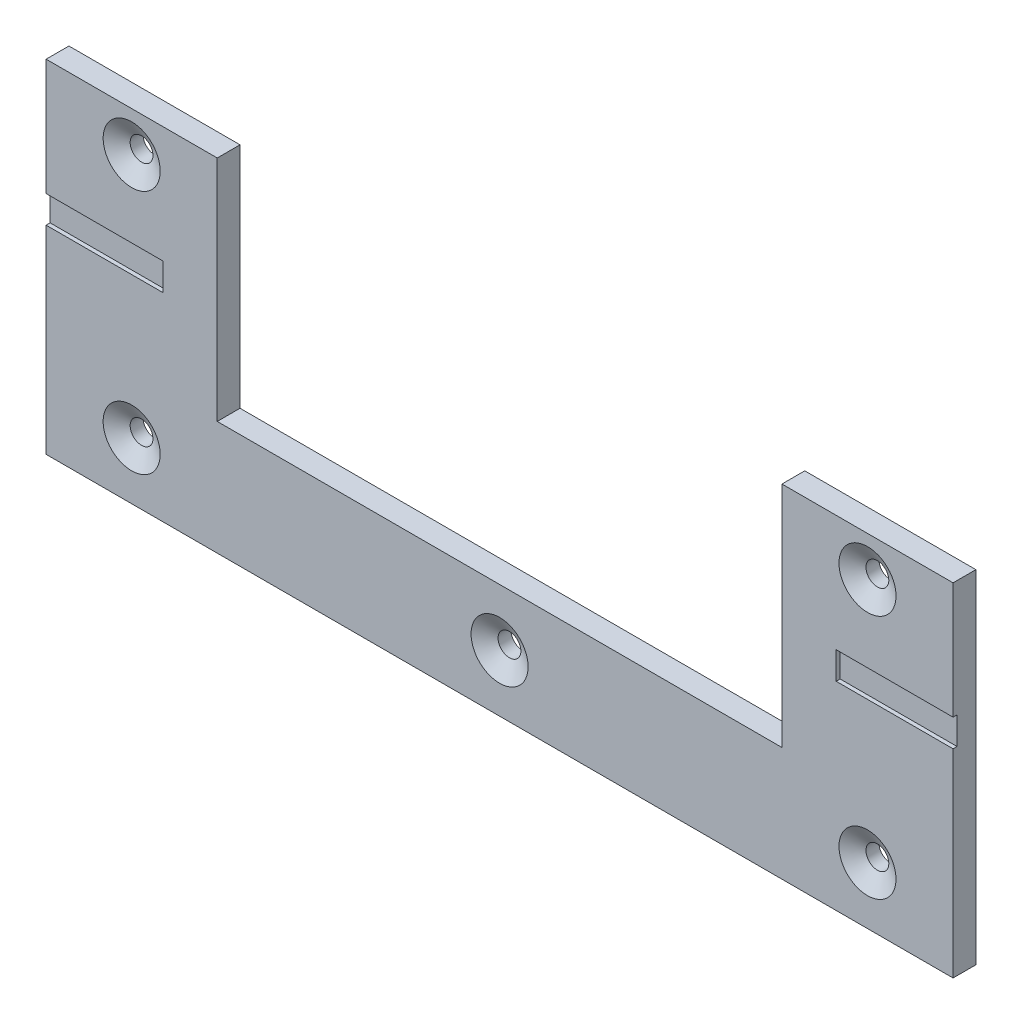
from build123d import *

# Parameters (mm, degrees)
ESQUISSE1_W             = 159
ESQUISSE1_H             = 60
BOSS_EXTRU_1_DEPTH      = 4
ENL_V_START             = -4
ESQUISSE2_W             = 20.5
ESQUISSE2_H             = 4.8
ENL_V_MAT_EXTRU_1_DEPTH = 0.7
ESQUISSE3_R             = 5.25
ENL_V_MAT_EXTRU_2_DEPTH = 2.3
ESQUISSE4_W             = 99
ESQUISSE4_H             = 40
ENL_V_MAT_EXTRU_3_DEPTH = 4
ESQUISSE5_R             = 2
ENL_V_MAT_EXTRU_4_DEPTH = 4
CHANFREIN1_SIZE         = 3
CHANFREIN1_SIZE2        = 1.732050808


with BuildPart() as part:
    # Esquisse1 → Boss.-Extru.1 (new body)
    with BuildSketch(Plane.XY):
        with Locations((79.5, 30)):
            Rectangle(ESQUISSE1_W, ESQUISSE1_H)
    extrude(amount=BOSS_EXTRU_1_DEPTH)

    # Esquisse2 → Enlèv. mat.-Extru.1 (cut)
    with BuildSketch(Plane(origin=(0, 0, 0), x_dir=(-1, 0, 0), z_dir=(0, 0, -1)).offset(ENL_V_START)):
        with Locations((-10.25, 37.2)):
            Rectangle(ESQUISSE2_W, ESQUISSE2_H)
        with Locations((-148.75, 37.2)):
            Rectangle(ESQUISSE2_W, ESQUISSE2_H)
    extrude(amount=ENL_V_MAT_EXTRU_1_DEPTH, mode=Mode.SUBTRACT)

    # Esquisse3 → Enlèv. mat.-Extru.2 (cut)
    with BuildSketch(Plane(origin=(0, 0, 0), x_dir=(-1, 0, 0), z_dir=(0, 0, -1))):
        with Locations((-12.5, 31.187269084)):
            Circle(ESQUISSE3_R)
        with Locations((-12.5, 43.187269084)):
            Circle(ESQUISSE3_R)
        with Locations((-146.5, 31.204694992)):
            Circle(ESQUISSE3_R)
        with Locations((-146.5, 43.187269084)):
            Circle(ESQUISSE3_R)
    extrude(amount=-ENL_V_MAT_EXTRU_2_DEPTH, mode=Mode.SUBTRACT)

    # Esquisse4 → Enlèv. mat.-Extru.3 (cut)
    with BuildSketch(Plane.XY.offset(4)):
        with Locations((79.5, 40)):
            Rectangle(ESQUISSE4_W, ESQUISSE4_H)
    extrude(amount=-ENL_V_MAT_EXTRU_3_DEPTH, mode=Mode.SUBTRACT)

    # Esquisse5 → Enlèv. mat.-Extru.4 (cut)
    with BuildSketch(Plane.XY.offset(4)):
        with Locations((15, 10)):
            Circle(ESQUISSE5_R)
        with Locations((144, 10)):
            Circle(ESQUISSE5_R)
        with Locations((15, 53)):
            Circle(ESQUISSE5_R)
        with Locations((144, 53)):
            Circle(ESQUISSE5_R)
        with Locations((79.5, 10)):
            Circle(ESQUISSE5_R)
    extrude(amount=-ENL_V_MAT_EXTRU_4_DEPTH, mode=Mode.SUBTRACT)

    # Chanfrein1
    chanfrein1_edges = [part.edges().sort_by_distance(p)[0] for p in [
        (13, 10, 4),
        (142, 10, 4),
        (13, 53, 4),
        (142, 53, 4),
        (77.5, 10, 4),
    ]]
    chanfrein1_side = [part.faces().sort_by_distance(p)[0] for p in [
        (10.25, 33.100558915, 4),
    ]]
    chamfer(chanfrein1_edges, length=CHANFREIN1_SIZE, length2=CHANFREIN1_SIZE2, reference=chanfrein1_side[0])


solid = part.part
